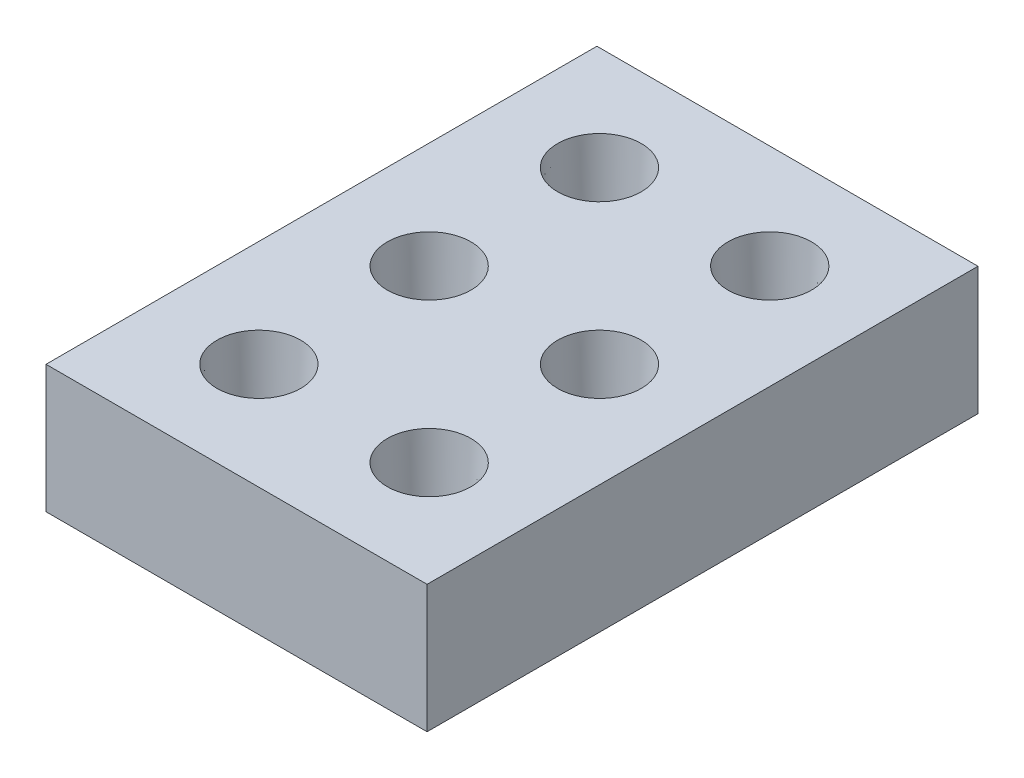
from build123d import *

# Parameters (mm, degrees)
SKETCH1_W            = 17.902420718
SKETCH1_H            = 25.880604579
BOSS_EXTRUDE1_DEPTH  = 6
LPATTERN1_COUNT      = 3
LPATTERN1_PITCH      = 8
LPATTERN1_COUNT_DIR2 = 2
LPATTERN1_PITCH_DIR2 = 8


with BuildPart() as part:
    # Sketch1 → Boss-Extrude1 (new body)
    with BuildSketch(Plane(origin=(0, 0, 0), x_dir=(1, 0, 0), z_dir=(0, 1, 0))):
        with Locations((3.951210359, 12.940302289)):
            Rectangle(SKETCH1_W, SKETCH1_H)
    extrude(amount=BOSS_EXTRUDE1_DEPTH)

    # Sketch3 → Cut-Revolve1 (revolve, cut)
    with BuildSketch(Plane.ZY, mode=Mode.PRIVATE) as cut_revolve1_sk:
        Polygon((-5, 6), (-5, 0), (-6.77, 0), (-6.77, 3.2), (-6.965795073, 6), align=None)
    cut_revolve1 = revolve(cut_revolve1_sk.sketch.rotate(Axis((0, 6, -5), (0, -1, 0)), 180), axis=Axis((0, 6, -5), (0, -1, 0)), mode=Mode.SUBTRACT)

    # LPattern1: Cut-Revolve1 3 × 2
    with Locations(*[(j * LPATTERN1_PITCH_DIR2, 0, -i * LPATTERN1_PITCH) for i in range(LPATTERN1_COUNT) for j in range(LPATTERN1_COUNT_DIR2) if (i, j) != (0, 0)]):
        add(cut_revolve1, mode=Mode.SUBTRACT)


solid = part.part
